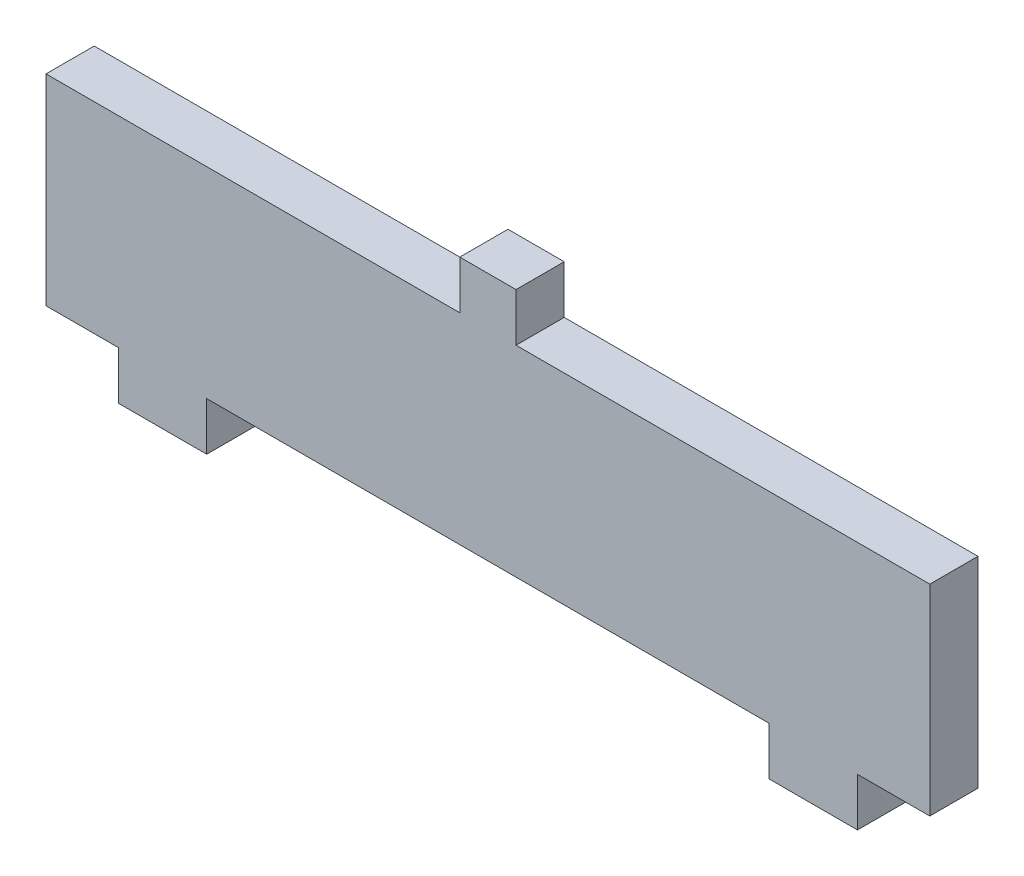
from build123d import *

# Parameters (mm, degrees)
SALIENTE_EXTRUIR1_DEPTH = 3


with BuildPart() as part:
    # Croquis1 → Saliente-Extruir1 (new body)
    with BuildSketch(Plane.XY):
        Polygon((1.75, 6.25), (27.5, 6.25), (27.5, -6.25), (23, -6.25), (23, -9.25), (17.5, -9.25), (17.5, -6.25), (-17.5, -6.25), (-17.5, -9.25), (-23, -9.25), (-23, -6.25), (-27.5, -6.25), (-27.5, 6.25), (-1.75, 6.25), (-1.75, 9.25), (1.75, 9.25), align=None)
    extrude(amount=SALIENTE_EXTRUIR1_DEPTH)


solid = part.part
